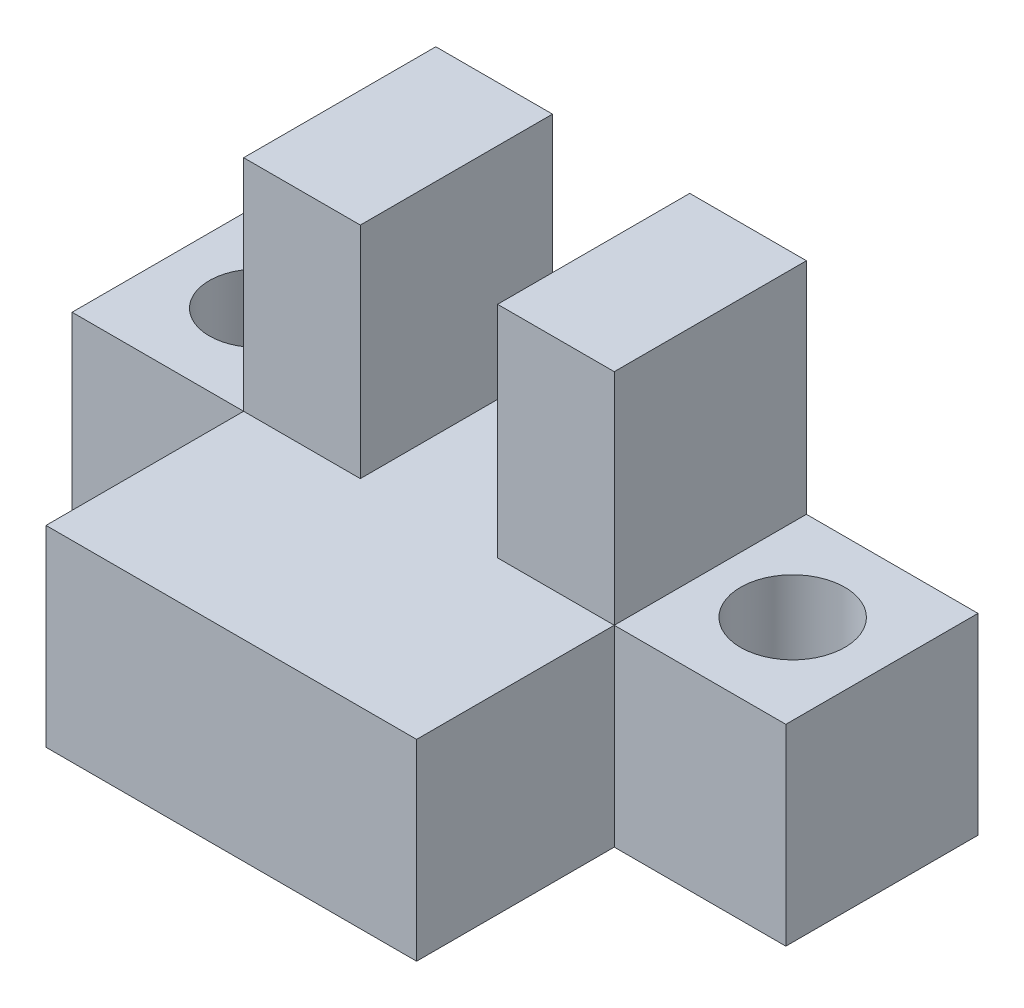
from build123d import *

# Parameters (mm, degrees)
BOSS_EXTRUDE1_DEPTH = 7
SKETCH2_W           = 4.25
SKETCH2_H           = 7
BOSS_EXTRUDE2_DEPTH = 8
SKETCH3_R           = 1.899478465
SKETCH3_R_2         = 1.75
CUT_EXTRUDE1_DEPTH  = 19


with BuildPart() as part:
    # Sketch1 → Boss-Extrude1 (new body)
    with BuildSketch(Plane(origin=(0, 0, 0), x_dir=(1, 0, 0), z_dir=(0, 1, 0))):
        Polygon((6.25, 0), (19.75, 0), (19.75, 7.2), (26, 7.2), (26, 14.2), (0, 14.2), (0, 7.2), (6.25, 7.2), align=None)
    extrude(amount=BOSS_EXTRUDE1_DEPTH)

    # Sketch2 → Boss-Extrude2 (add)
    with BuildSketch(Plane(origin=(0, 7, 0), x_dir=(1, 0, 0), z_dir=(0, 1, 0))):
        with Locations((8.375, 10.7)):
            Rectangle(SKETCH2_W, SKETCH2_H)
        with Locations((17.625, 10.7)):
            Rectangle(SKETCH2_W, SKETCH2_H)
    extrude(amount=BOSS_EXTRUDE2_DEPTH)

    # Sketch3 → Cut-Extrude1 (cut)
    with BuildSketch(Plane(origin=(0, 7, 0), x_dir=(1, 0, 0), z_dir=(0, 1, 0))):
        with Locations(Location((22.75, 10.7, 0), (0, 0, 270))):
            Circle(SKETCH3_R)
        with Locations(Location((3.25, 10.7, 0), (0, 0, 270))):
            Circle(SKETCH3_R_2)
    extrude(amount=-CUT_EXTRUDE1_DEPTH, mode=Mode.SUBTRACT)


solid = part.part
